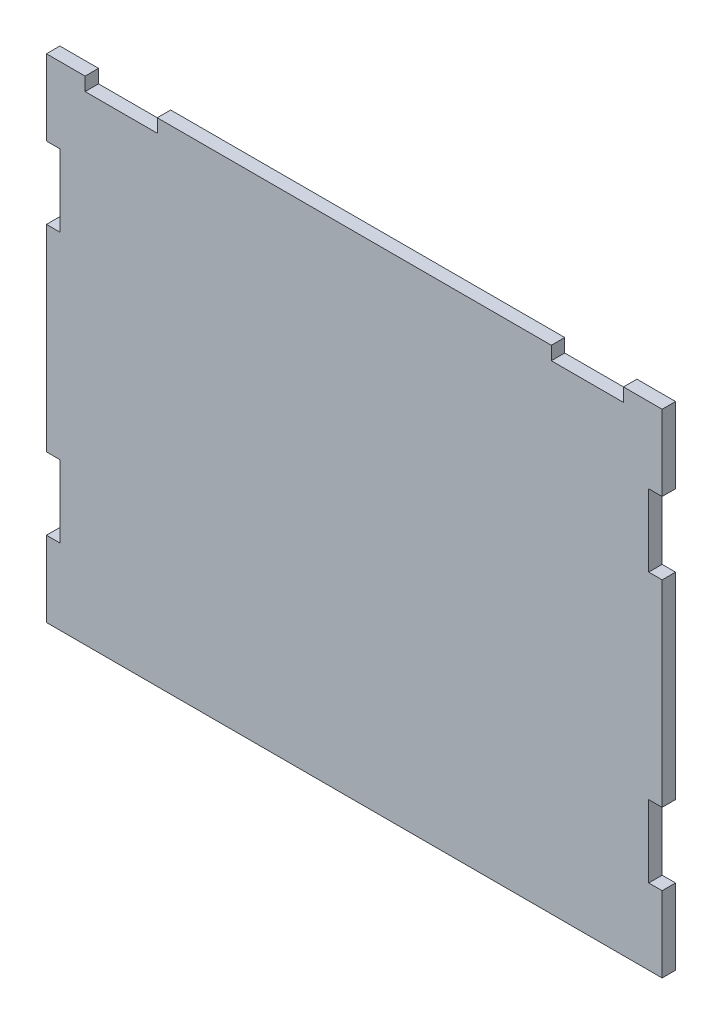
from build123d import *

# Parameters (mm, degrees)
EXTRUDE_1_DEPTH = 5.45


with BuildPart() as part:
    # Эскиз1 → Бобышка-Вытянуть1 (new body)
    with BuildSketch(Plane.XY):
        Polygon((-234.3, 0), (-250, 0), (-250, -30.7), (-244.55, -30.7), (-244.55, -60), (-250, -60), (-250, -140), (-244.55, -140), (-244.55, -169.3), (-250, -169.3), (-250, -200), (0, -200), (0, -169.3), (-5.45, -169.3), (-5.45, -140), (0, -140), (0, -60), (-5.45, -60), (-5.45, -30.7), (0, -30.7), (0, 0), (-15.7, 0), (-15.7, -5.45), (-45, -5.45), (-45, 0), (-205, 0), (-205, -5.45), (-234.3, -5.45), align=None)
    extrude(amount=EXTRUDE_1_DEPTH)


solid = part.part
